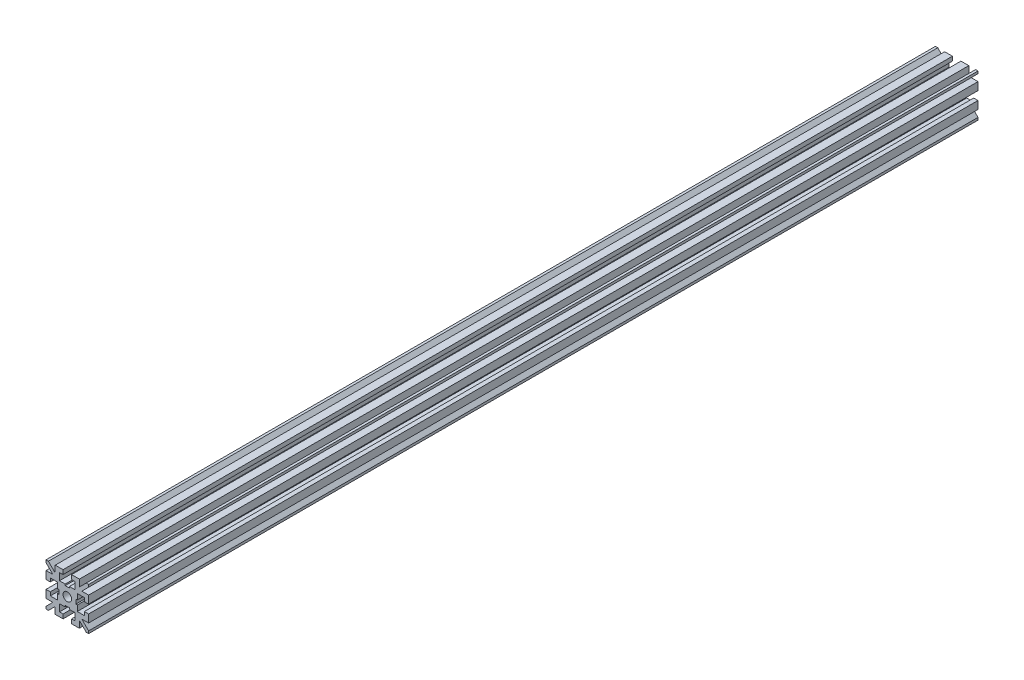
from build123d import *

# Parameters (mm, degrees)
SKETCH1_W           = 15
SKETCH1_H           = 15
BOSS_EXTRUDE1_DEPTH = 313
SKETCH2_R           = 1.5
CUT_EXTRUDE1_DEPTH  = 313
SKETCH3_W           = 3
SKETCH3_H           = 1.5
SKETCH3_W_2         = 1.5
SKETCH3_H_2         = 3
CUT_EXTRUDE2_DEPTH  = 313


with BuildPart() as part:
    # Sketch1 → Boss-Extrude1 (new body)
    with BuildSketch(Plane.XY):
        with Locations((-1.500578266, -3.738353388)):
            Rectangle(SKETCH1_W, SKETCH1_H)
    extrude(amount=BOSS_EXTRUDE1_DEPTH)

    # Sketch2 → Cut-Extrude1 (cut)
    with BuildSketch(Plane.XY.offset(313)):
        with Locations((-1.500578266, -3.738353388)):
            Circle(SKETCH2_R)
        Polygon((1.999421734, -4.488353388), (1.999421734, -6.488353388), (4.499421734, -6.488353388), (4.499421734, -0.988353388), (1.999421734, -0.988353388), (1.999421734, -2.988353388), (1.499421734, -2.988353388), (1.499421734, -4.488353388), align=None)
        Polygon((-4.250578266, -7.238353388), (-4.250578266, -9.738353388), (1.249421734, -9.738353388), (1.249421734, -7.238353388), (-0.750578266, -7.238353388), (-0.750578266, -6.738353388), (-2.250578266, -6.738353388), (-2.250578266, -7.238353388), align=None)
        Polygon((-5.000578266, -0.988353388), (-7.500578266, -0.988353388), (-7.500578266, -6.488353388), (-5.000578266, -6.488353388), (-5.000578266, -4.488353388), (-4.500578266, -4.488353388), (-4.500578266, -2.988353388), (-5.000578266, -2.988353388), align=None)
        Polygon((1.249421734, -0.238353388), (1.249421734, 2.261646612), (-4.250578266, 2.261646612), (-4.250578266, -0.238353388), (-2.250578266, -0.238353388), (-2.250578266, -0.738353388), (-0.750578266, -0.738353388), (-0.750578266, -0.238353388), align=None)
    extrude(amount=-CUT_EXTRUDE1_DEPTH, mode=Mode.SUBTRACT)

    # Sketch3 → Cut-Extrude2 (cut)
    with BuildSketch(Plane.XY.offset(313)):
        Polygon((5.150893596, 3.761646612), (2.749421734, 1.360174749), (2.749421734, 3.761646612), align=None)
        Polygon((5.999421734, 0.511646612), (5.999421734, 2.913118474), (3.597949871, 0.511646612), align=None)
        with Locations((-1.500578266, 3.011646612)):
            Rectangle(SKETCH3_W, SKETCH3_H)
        Polygon((2.749421734, -8.836881526), (2.749421734, -11.238353388), (5.150893596, -11.238353388), align=None)
        Polygon((5.999421734, -10.389825251), (3.597949871, -7.988353388), (5.999421734, -7.988353388), align=None)
        with Locations((5.249421734, -3.738353388)):
            Rectangle(SKETCH3_W_2, SKETCH3_H_2)
        Polygon((-6.599106404, -7.988353388), (-9.000578266, -7.988353388), (-9.000578266, -10.389825251), align=None)
        Polygon((-8.152050129, -11.238353388), (-5.750578266, -8.836881526), (-5.750578266, -11.238353388), align=None)
        with Locations((-1.500578266, -10.488353388)):
            Rectangle(SKETCH3_W, SKETCH3_H)
        Polygon((-5.750578266, 1.360174749), (-5.750578266, 3.761646612), (-8.152050129, 3.761646612), align=None)
        Polygon((-9.000578266, 2.913118474), (-6.599106404, 0.511646612), (-9.000578266, 0.511646612), align=None)
        with Locations((-8.250578266, -3.738353388)):
            Rectangle(SKETCH3_W_2, SKETCH3_H_2)
    extrude(amount=-CUT_EXTRUDE2_DEPTH, mode=Mode.SUBTRACT)


solid = part.part
